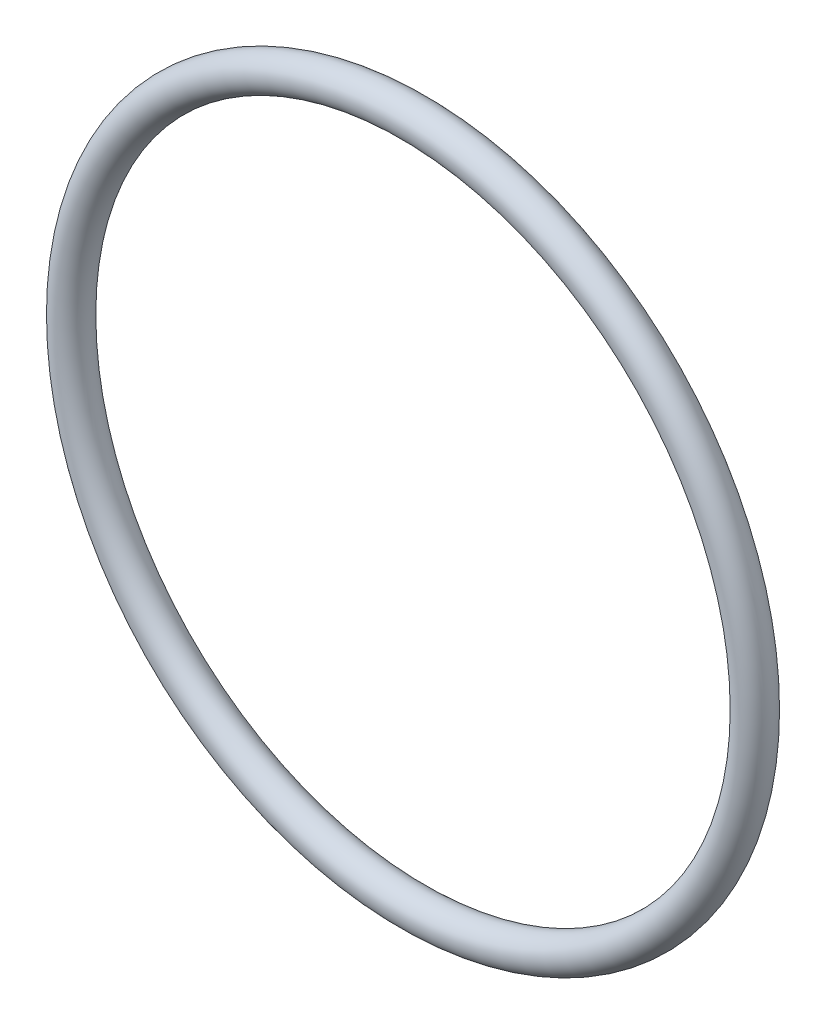
from build123d import *

# Parameters (mm, degrees)
SKETCH1_R = 0.889


with BuildPart() as part:
    # Sketch1 → Revolve1 (revolve)
    with BuildSketch(Plane(origin=(0, 0, 0), x_dir=(0, -1, 0), z_dir=(1, 0, 0)), mode=Mode.PRIVATE) as revolve1_sk:
        with Locations((17.4117, 0)):
            Circle(SKETCH1_R)
    revolve(revolve1_sk.sketch.rotate(Axis((0, 0, 0.889), (0, 0, -1)), 270), axis=Axis((0, 0, 0.889), (0, 0, -1)))


solid = part.part
